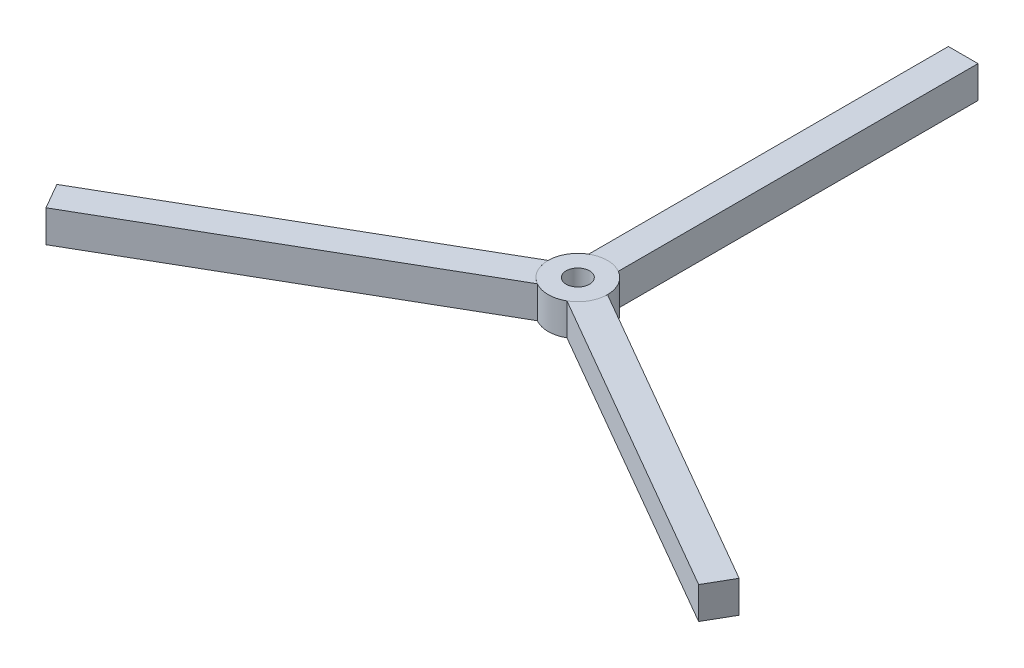
from build123d import *

# Parameters (mm, degrees)
SKETCH1_R                            = 6.35
SKETCH1_R_2                          = 2.499995
BOSS_EXTRUDE1_DEPTH                  = 6.858
SKETCH3_W                            = 6.35
SKETCH3_H                            = 6.858
BOSS_EXTRUDE2_DEPTH                  = 76.2
BOSS_EXTRUDE2_DIRECTION_2_REACH      = 17.768
BOSS_EXTRUDE2_DIRECTION_2_END_RADIUS = 6.35
CIRPATTERN5_COUNT                    = 3


with BuildPart() as part:
    # Sketch1 → Boss-Extrude1 (new body)
    with BuildSketch(Plane(origin=(0, 0, 0), x_dir=(1, 0, 0), z_dir=(0, 1, 0))):
        with Locations(Location((0, 0, 0), (0, 0, 270))):
            Circle(SKETCH1_R)
        with Locations(Location((0, 0, 0), (0, 0, 270))):
            Circle(SKETCH1_R_2, mode=Mode.SUBTRACT)
    extrude(amount=BOSS_EXTRUDE1_DEPTH)


with BuildPart() as body_2:
    # Sketch3 → Boss-Extrude2 (new body)
    with BuildSketch(Plane(origin=(0, 0, -6.35), x_dir=(-1, 0, 0), z_dir=(0, 0, -1))):
        with Locations((0, 3.429)):
            Rectangle(SKETCH3_W, SKETCH3_H)
    extrude(amount=BOSS_EXTRUDE2_DEPTH)

    # Boss-Extrude2 direction 2: up to this cylinder (the profile starts outside it)
    boss_extrude2_direction_2_end = Plane(origin=(0, 3.429, 0), z_dir=(0, -1, 0)) * Cylinder(BOSS_EXTRUDE2_DIRECTION_2_END_RADIUS, 49.236, mode=Mode.PRIVATE)
    # Sketch3 → Boss-Extrude2 direction 2 (add, up to the surface)
    with BuildSketch(Plane(origin=(0, 0, -6.35), x_dir=(-1, 0, 0), z_dir=(0, 0, -1)), mode=Mode.PRIVATE) as boss_extrude2_direction_2_sk1:
        with Locations((0, 3.429)):
            Rectangle(SKETCH3_W, SKETCH3_H)
    boss_extrude2_direction_2_tool1 = extrude(boss_extrude2_direction_2_sk1.sketch, amount=-BOSS_EXTRUDE2_DIRECTION_2_REACH, mode=Mode.PRIVATE) - boss_extrude2_direction_2_end
    add(boss_extrude2_direction_2_tool1.solids().sort_by_distance((0, 3.429, -6.35))[0])
    add(boss_extrude2_direction_2_tool1.solids().sort_by_distance((0, 3.429, -6.35))[1])


with BuildPart() as cirpattern5_1:
    # CirPattern5: pattern copy
    add(body_2.part.rotate(Axis((0, 0, 0), (0, 1, 0)), 1 * 360 / CIRPATTERN5_COUNT))


with BuildPart() as cirpattern5_2:
    # CirPattern5: pattern copy
    add(body_2.part.rotate(Axis((0, 0, 0), (0, 1, 0)), 2 * 360 / CIRPATTERN5_COUNT))


solid = Compound([part.part, body_2.part, cirpattern5_1.part, cirpattern5_2.part])
